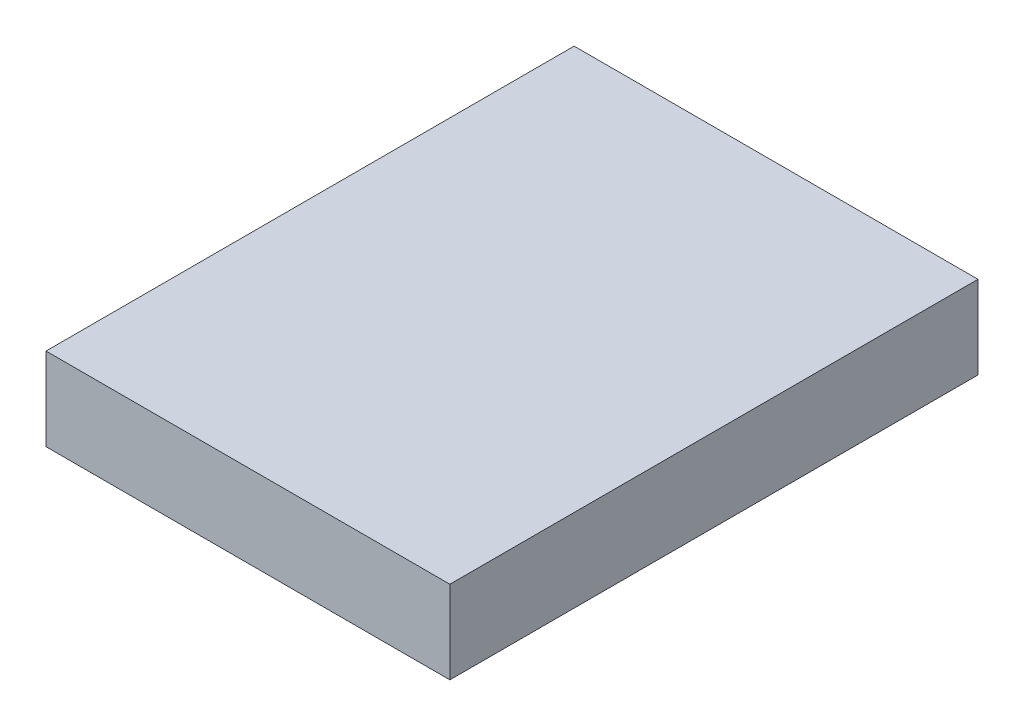
from build123d import *

# Parameters (mm, degrees)
SKETCH1_W           = 39
SKETCH1_H           = 51
BOSS_EXTRUDE1_DEPTH = 8


with BuildPart() as part:
    # Sketch1 → Boss-Extrude1 (new body)
    with BuildSketch(Plane(origin=(0, 0, 0), x_dir=(1, 0, 0), z_dir=(0, 1, 0))):
        Rectangle(SKETCH1_W, SKETCH1_H)
    extrude(amount=BOSS_EXTRUDE1_DEPTH)


solid = part.part
